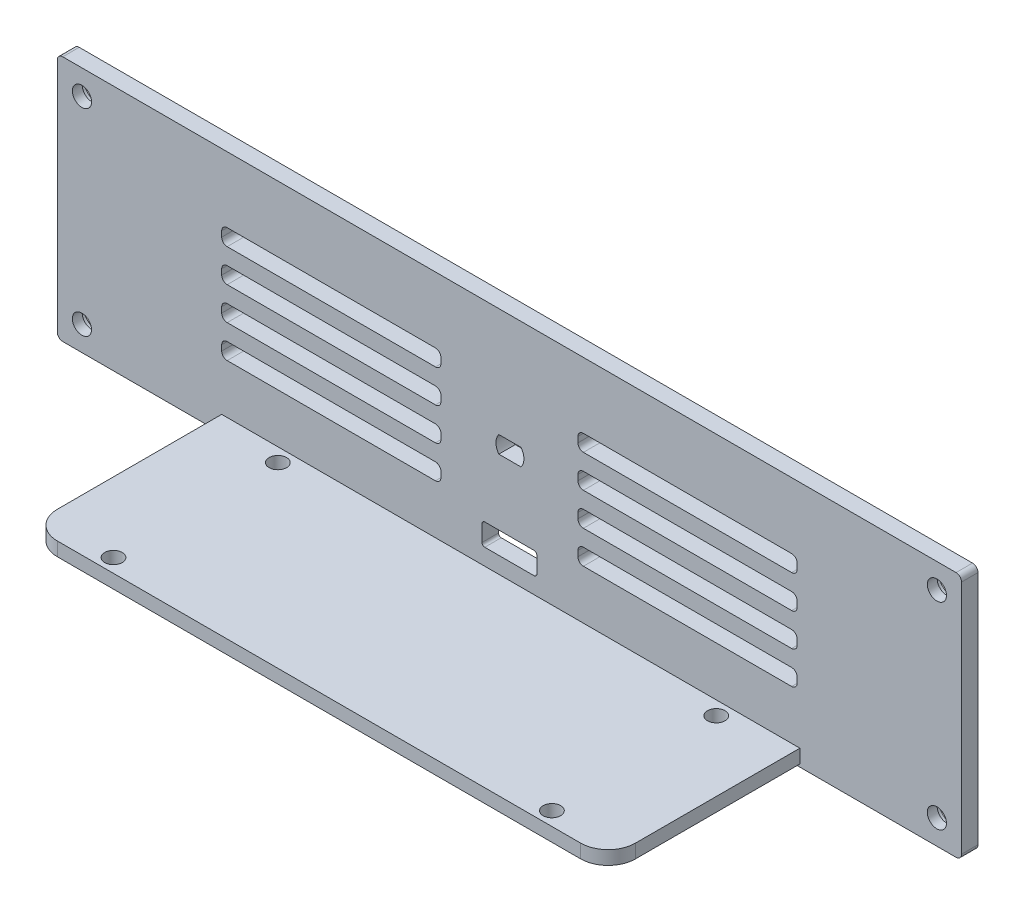
from build123d import *

# Parameters (mm, degrees)
SKETCH_1_W          = 165
SKETCH_1_H          = 45
SKETCH_1_R          = 1.75
SKETCH_1_R_2        = 2.55
SKETCH_1_W_2        = 105.5
SKETCH_1_H_2        = 2.5
EXTRUDE_2_DEPTH     = 3
SKETCH_1_5_R        = 2.75
SKETCH_1_5_R_2      = 1.75
CUT_EXTRUDE_2_DEPTH = 1.2
SKETCH_1_7_W        = 105.5
SKETCH_1_7_H        = 2.5
EXTRUDE_3_DEPTH     = 38
FILLET_1_R          = 5
FILLET_2_R          = 1
SKETCH_3D_1_R       = 1.6
CUT_EXTRUDE_3_DEPTH = 2.5
EXTRUDE_5_DEPTH     = 3


with BuildPart() as part:
    # 草图1 → 凸台-拉伸2 (new body)
    with BuildSketch(Plane.XY):
        with Locations((12.080789946, 2.099629791)):
            Rectangle(SKETCH_1_W, SKETCH_1_H)
        with Locations((-65.919210054, 20.099629791)):
            Circle(SKETCH_1_R, mode=Mode.SUBTRACT)
        with Locations((-65.919210054, -15.900370209)):
            Circle(SKETCH_1_R, mode=Mode.SUBTRACT)
        with Locations((90.080789946, -15.900370209)):
            Circle(SKETCH_1_R, mode=Mode.SUBTRACT)
        with Locations((90.080789946, 20.099629791)):
            Circle(SKETCH_1_R, mode=Mode.SUBTRACT)
        with Locations((12.17205321, 3.14535325)):
            Circle(SKETCH_1_R_2, mode=Mode.SUBTRACT)
        with BuildLine():
            Line((25.580789946, 12.599629791), (63.580789946, 12.599629791))
            ThreePointArc((63.580789946, 12.599629791), (64.287896727, 12.306736572), (64.580789946, 11.599629791))
            Line((64.580789946, 11.599629791), (64.580789946, 10.599629791))
            ThreePointArc((64.580789946, 10.599629791), (64.287896727, 9.89252301), (63.580789946, 9.599629791))
            Line((63.580789946, 9.599629791), (25.580789946, 9.599629791))
            ThreePointArc((25.580789946, 9.599629791), (24.873683165, 9.89252301), (24.580789946, 10.599629791))
            Line((24.580789946, 10.599629791), (24.580789946, 11.599629791))
            ThreePointArc((24.580789946, 11.599629791), (24.873683165, 12.306736572), (25.580789946, 12.599629791))
        make_face(mode=Mode.SUBTRACT)
        with BuildLine():
            Line((-39.419210054, 12.599629791), (-1.419210054, 12.599629791))
            ThreePointArc((-1.419210054, 12.599629791), (-0.712103273, 12.306736572), (-0.419210054, 11.599629791))
            Line((-0.419210054, 11.599629791), (-0.419210054, 10.599629791))
            ThreePointArc((-0.419210054, 10.599629791), (-0.712103273, 9.89252301), (-1.419210054, 9.599629791))
            Line((-1.419210054, 9.599629791), (-39.419210054, 9.599629791))
            ThreePointArc((-39.419210054, 9.599629791), (-40.126316835, 9.89252301), (-40.419210054, 10.599629791))
            Line((-40.419210054, 10.599629791), (-40.419210054, 11.599629791))
            ThreePointArc((-40.419210054, 11.599629791), (-40.126316835, 12.306736572), (-39.419210054, 12.599629791))
        make_face(mode=Mode.SUBTRACT)
        with BuildLine():
            Line((25.580789946, 6.599629791), (63.580789946, 6.599629791))
            ThreePointArc((63.580789946, 6.599629791), (64.287896727, 6.306736572), (64.580789946, 5.599629791))
            Line((64.580789946, 5.599629791), (64.580789946, 4.599629791))
            ThreePointArc((64.580789946, 4.599629791), (64.287896727, 3.89252301), (63.580789946, 3.599629791))
            Line((63.580789946, 3.599629791), (25.580789946, 3.599629791))
            ThreePointArc((25.580789946, 3.599629791), (24.873683165, 3.89252301), (24.580789946, 4.599629791))
            Line((24.580789946, 4.599629791), (24.580789946, 5.599629791))
            ThreePointArc((24.580789946, 5.599629791), (24.873683165, 6.306736572), (25.580789946, 6.599629791))
        make_face(mode=Mode.SUBTRACT)
        with BuildLine():
            Line((25.580789946, 0.599629791), (63.580789946, 0.599629791))
            ThreePointArc((63.580789946, 0.599629791), (64.287896727, 0.306736572), (64.580789946, -0.400370209))
            Line((64.580789946, -0.400370209), (64.580789946, -1.400370209))
            ThreePointArc((64.580789946, -1.400370209), (64.287896727, -2.10747699), (63.580789946, -2.400370209))
            Line((63.580789946, -2.400370209), (25.580789946, -2.400370209))
            ThreePointArc((25.580789946, -2.400370209), (24.873683165, -2.10747699), (24.580789946, -1.400370209))
            Line((24.580789946, -1.400370209), (24.580789946, -0.400370209))
            ThreePointArc((24.580789946, -0.400370209), (24.873683165, 0.306736572), (25.580789946, 0.599629791))
        make_face(mode=Mode.SUBTRACT)
        with BuildLine():
            Line((25.580789946, -5.400370209), (63.580789946, -5.400370209))
            ThreePointArc((63.580789946, -5.400370209), (64.287896727, -5.693263428), (64.580789946, -6.400370209))
            Line((64.580789946, -6.400370209), (64.580789946, -7.400370209))
            ThreePointArc((64.580789946, -7.400370209), (64.287896727, -8.10747699), (63.580789946, -8.400370209))
            Line((63.580789946, -8.400370209), (25.580789946, -8.400370209))
            ThreePointArc((25.580789946, -8.400370209), (24.873683165, -8.10747699), (24.580789946, -7.400370209))
            Line((24.580789946, -7.400370209), (24.580789946, -6.400370209))
            ThreePointArc((24.580789946, -6.400370209), (24.873683165, -5.693263428), (25.580789946, -5.400370209))
        make_face(mode=Mode.SUBTRACT)
        with BuildLine():
            Line((-39.419210054, 6.599629791), (-1.419210054, 6.599629791))
            ThreePointArc((-1.419210054, 6.599629791), (-0.712103273, 6.306736572), (-0.419210054, 5.599629791))
            Line((-0.419210054, 5.599629791), (-0.419210054, 4.599629791))
            ThreePointArc((-0.419210054, 4.599629791), (-0.712103273, 3.89252301), (-1.419210054, 3.599629791))
            Line((-1.419210054, 3.599629791), (-39.419210054, 3.599629791))
            ThreePointArc((-39.419210054, 3.599629791), (-40.126316835, 3.89252301), (-40.419210054, 4.599629791))
            Line((-40.419210054, 4.599629791), (-40.419210054, 5.599629791))
            ThreePointArc((-40.419210054, 5.599629791), (-40.126316835, 6.306736572), (-39.419210054, 6.599629791))
        make_face(mode=Mode.SUBTRACT)
        with BuildLine():
            Line((-39.419210054, 0.599629791), (-1.419210054, 0.599629791))
            ThreePointArc((-1.419210054, 0.599629791), (-0.712103273, 0.306736572), (-0.419210054, -0.400370209))
            Line((-0.419210054, -0.400370209), (-0.419210054, -1.400370209))
            ThreePointArc((-0.419210054, -1.400370209), (-0.712103273, -2.10747699), (-1.419210054, -2.400370209))
            Line((-1.419210054, -2.400370209), (-39.419210054, -2.400370209))
            ThreePointArc((-39.419210054, -2.400370209), (-40.126316835, -2.10747699), (-40.419210054, -1.400370209))
            Line((-40.419210054, -1.400370209), (-40.419210054, -0.400370209))
            ThreePointArc((-40.419210054, -0.400370209), (-40.126316835, 0.306736572), (-39.419210054, 0.599629791))
        make_face(mode=Mode.SUBTRACT)
        with BuildLine():
            Line((-39.419210054, -5.400370209), (-1.419210054, -5.400370209))
            ThreePointArc((-1.419210054, -5.400370209), (-0.712103273, -5.693263428), (-0.419210054, -6.400370209))
            Line((-0.419210054, -6.400370209), (-0.419210054, -7.400370209))
            ThreePointArc((-0.419210054, -7.400370209), (-0.712103273, -8.10747699), (-1.419210054, -8.400370209))
            Line((-1.419210054, -8.400370209), (-39.419210054, -8.400370209))
            ThreePointArc((-39.419210054, -8.400370209), (-40.126316835, -8.10747699), (-40.419210054, -7.400370209))
            Line((-40.419210054, -7.400370209), (-40.419210054, -6.400370209))
            ThreePointArc((-40.419210054, -6.400370209), (-40.126316835, -5.693263428), (-39.419210054, -5.400370209))
        make_face(mode=Mode.SUBTRACT)
        with BuildLine():
            Line((7.580789946, -10.400370209), (16.580789946, -10.400370209))
            ThreePointArc((16.580789946, -10.400370209), (16.934343337, -10.546816818), (17.080789946, -10.900370209))
            Line((17.080789946, -10.900370209), (17.080789946, -13.900370209))
            ThreePointArc((17.080789946, -13.900370209), (16.934343337, -14.253923599), (16.580789946, -14.400370209))
            Line((16.580789946, -14.400370209), (7.580789946, -14.400370209))
            ThreePointArc((7.580789946, -14.400370209), (7.227236556, -14.253923599), (7.080789946, -13.900370209))
            Line((7.080789946, -13.900370209), (7.080789946, -10.900370209))
            ThreePointArc((7.080789946, -10.900370209), (7.227236556, -10.546816818), (7.580789946, -10.400370209))
        make_face(mode=Mode.SUBTRACT)
        with Locations((12.330789946, -18.650370209)):
            Rectangle(SKETCH_1_W_2, SKETCH_1_H_2, mode=Mode.SUBTRACT)
    extrude(amount=EXTRUDE_2_DEPTH)

    # 草图1<5> → 切除-拉伸2 (cut)
    # profile 1 of 4: a face of its own
    with BuildSketch(Plane.XY):
        with Locations((90.080789946, 20.099629791)):
            Circle(SKETCH_1_5_R)
        with Locations((90.080789946, 20.099629791)):
            Circle(SKETCH_1_5_R_2, mode=Mode.SUBTRACT)
    # profile 2 of 4: a face of its own
    with BuildSketch(Plane.XY):
        with Locations((90.080789946, -15.900370209)):
            Circle(SKETCH_1_5_R)
        with Locations((90.080789946, -15.900370209)):
            Circle(SKETCH_1_5_R_2, mode=Mode.SUBTRACT)
    # profile 3 of 4: a face of its own
    with BuildSketch(Plane.XY):
        with Locations((-65.919210054, 20.099629791)):
            Circle(SKETCH_1_5_R)
        with Locations((-65.919210054, 20.099629791)):
            Circle(SKETCH_1_5_R_2, mode=Mode.SUBTRACT)
    # profile 4 of 4: a face of its own
    with BuildSketch(Plane.XY):
        with Locations((-65.919210054, -15.900370209)):
            Circle(SKETCH_1_5_R)
        with Locations((-65.919210054, -15.900370209)):
            Circle(SKETCH_1_5_R_2, mode=Mode.SUBTRACT)
    extrude(amount=CUT_EXTRUDE_2_DEPTH, mode=Mode.SUBTRACT)

    # 草图1<7> → 凸台-拉伸3 (add)
    with BuildSketch(Plane.XY):
        with Locations((12.330789946, -18.650370209)):
            Rectangle(SKETCH_1_7_W, SKETCH_1_7_H)
    extrude(amount=EXTRUDE_3_DEPTH)

    # 圆角1
    fillet_1_edges = [part.edges().sort_by_distance(p)[0] for p in [
        (65.080789946, -18.650370209, 38),
        (-40.419210054, -18.650370209, 38),
    ]]
    fillet(fillet_1_edges, radius=FILLET_1_R)

    # 圆角2
    fillet_2_edges = [part.edges().sort_by_distance(p)[0] for p in [
        (94.580789946, -20.400370209, 1.5),
        (-70.419210054, -20.400370209, 1.5),
        (-70.419210054, 24.599629791, 1.5),
        (94.580789946, 24.599629791, 1.5),
    ]]
    fillet(fillet_2_edges, radius=FILLET_2_R)

    # Sketch 3D_1 → 切除-拉伸3 (cut)
    with BuildSketch(Plane(origin=(-27.669210054, -17.400370209, 5.5), x_dir=(0.9363291775690445, 0, 0.35112344158839165), z_dir=(0, -1, 0))):
        with Locations(Location((0, 0, 0), (0, 0, 159.44395478))):
            Circle(SKETCH_3D_1_R)
        with Locations(Location((74.906334206, -28.089875327, 0), (0, 0, 159.44395478))):
            Circle(SKETCH_3D_1_R)
        with Locations(Location((10.533703248, 28.089875327, 0), (0, 0, 159.44395478))):
            Circle(SKETCH_3D_1_R)
        with Locations(Location((85.440037453, 0, 0), (0, 0, 159.44395478))):
            Circle(SKETCH_3D_1_R)
    extrude(amount=CUT_EXTRUDE_3_DEPTH, mode=Mode.SUBTRACT)

    # 草图1<10> → 凸台-拉伸5 (add)
    with BuildSketch(Plane.XY):
        with BuildLine():
            Line((10.14705321, 4.695151624), (14.19705321, 4.695151624))
            ThreePointArc((14.19705321, 4.695151624), (12.17205321, 5.69535325), (10.14705321, 4.695151624))
        make_face()
        with BuildLine():
            ThreePointArc((10.14705321, 1.595554876), (12.17205321, 0.59535325), (14.19705321, 1.595554876))
            Line((14.19705321, 1.595554876), (10.14705321, 1.595554876))
        make_face()
    extrude(amount=EXTRUDE_5_DEPTH)


solid = part.part
